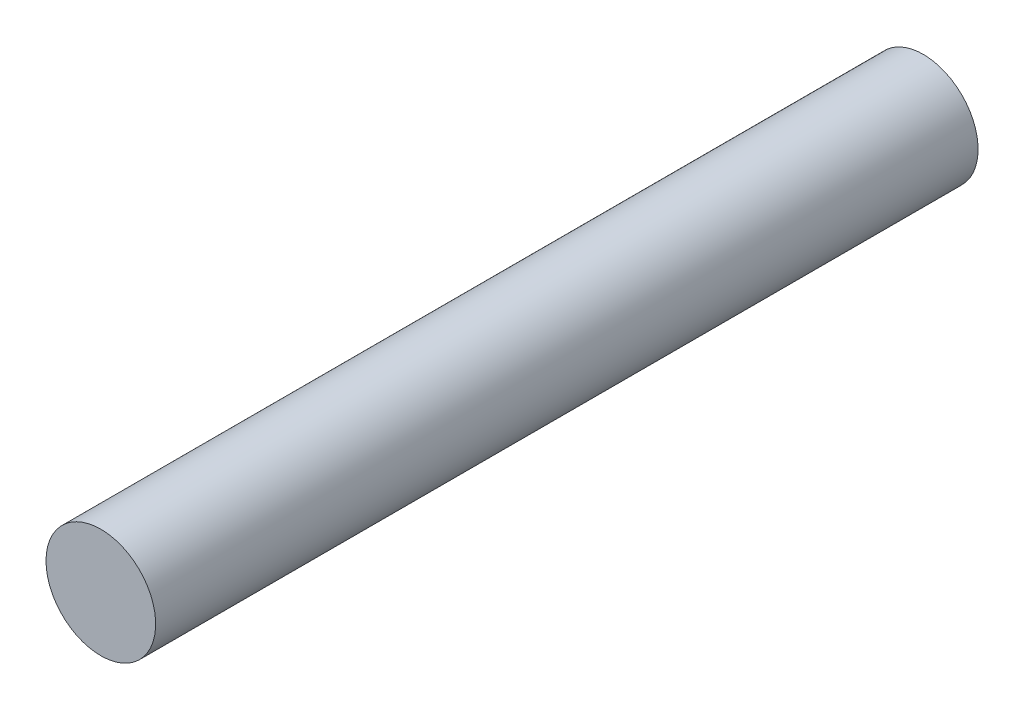
from build123d import *

# Parameters (mm, degrees)
SKETCH1_R           = 6
BOSS_EXTRUDE1_DEPTH = 90


with BuildPart() as part:
    # Sketch1 → Boss-Extrude1 (new body)
    with BuildSketch(Plane.XY):
        with Locations(Location((0, 0, 0), (0, 0, 180))):
            Circle(SKETCH1_R)
    extrude(amount=BOSS_EXTRUDE1_DEPTH)


solid = part.part
